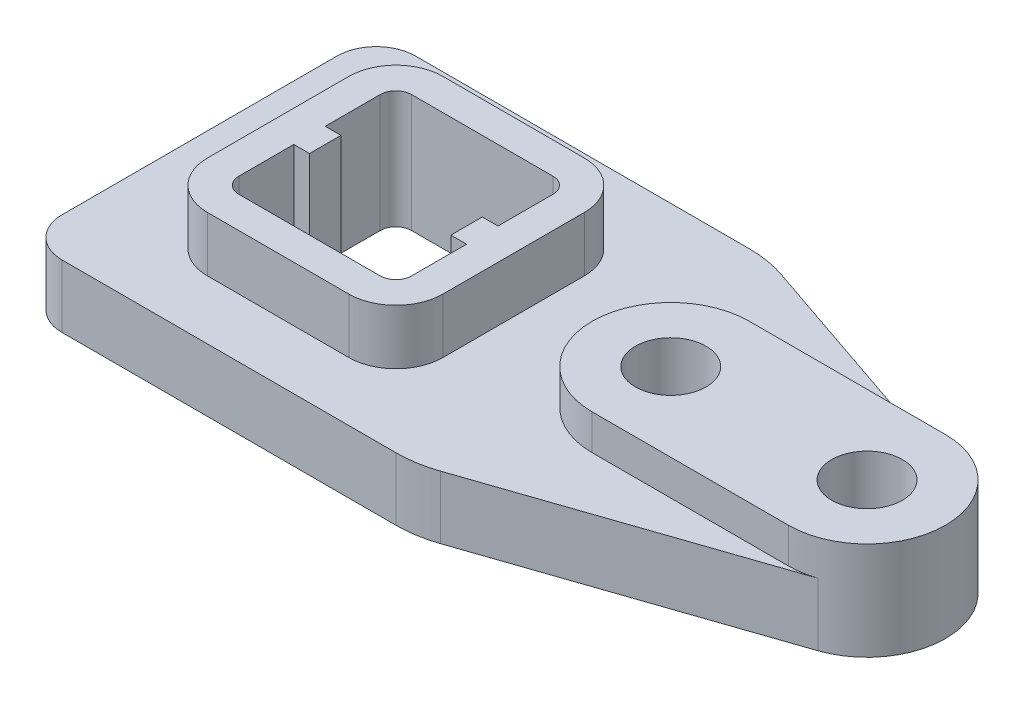
from build123d import *

# Parameters (mm, degrees)
SKETCH_1_W          = 100
SKETCH_1_H          = 90
EXTRUDE_1_DEPTH     = 16
FILLET_1_R          = 10
SKETCH_4_W          = 60
SKETCH_4_H          = 60
EXTRUDE_2_DEPTH     = 30
FILLET_3_R          = 12
CUT_EXTRUDE_1_DEPTH = 46
FILLET_4_R          = 4
EXTRUDE_4_DEPTH     = 16
SKETCH_10_R         = 9
EXTRUDE_5_DEPTH     = 25
FILLET_6_R          = 30


with BuildPart() as part:
    # 草图1 → 凸台-拉伸1 (new body)
    with BuildSketch(Plane(origin=(0, 0, 0), x_dir=(1, 0, 0), z_dir=(0, 1, 0))):
        with Locations((50, 0)):
            Rectangle(SKETCH_1_W, SKETCH_1_H)
    extrude(amount=EXTRUDE_1_DEPTH)

    # 圆角1
    fillet_1_edges = [part.edges().sort_by_distance(p)[0] for p in [
        (0, 8, -45),
        (0, 8, 45),
    ]]
    fillet(fillet_1_edges, radius=FILLET_1_R)

    # 草图4 → 凸台-拉伸2 (add)
    with BuildSketch(Plane(origin=(0, 0, 0), x_dir=(1, 0, 0), z_dir=(0, 1, 0))):
        with Locations((50, 0)):
            Rectangle(SKETCH_4_W, SKETCH_4_H)
    extrude(amount=EXTRUDE_2_DEPTH)

    # 圆角3
    fillet_3_edges = [part.edges().sort_by_distance(p)[0] for p in [
        (20, 23, -30),
        (20, 23, 30),
        (80, 23, 30),
        (80, 23, -30),
    ]]
    fillet(fillet_3_edges, radius=FILLET_3_R)

    # 草图5 → 切除-拉伸1 (cut)
    with BuildSketch(Plane(origin=(0, 0, 0), x_dir=(1, 0, 0), z_dir=(0, 1, 0))):
        Polygon((28, -4), (28, -22), (72, -22), (72, -4), (68, -4), (68, 4), (72, 4), (72, 22), (28, 22), (28, 4), (32, 4), (32, -4), align=None)
    extrude(amount=CUT_EXTRUDE_1_DEPTH, mode=Mode.SUBTRACT)

    # 圆角4
    fillet_4_edges = [part.edges().sort_by_distance(p)[0] for p in [
        (28, 15, -22),
        (28, 15, 22),
        (72, 15, 22),
        (72, 15, -22),
    ]]
    fillet(fillet_4_edges, radius=FILLET_4_R)

    # 草图9 → 凸台-拉伸4 (add)
    with BuildSketch(Plane(origin=(0, 0, 0), x_dir=(1, 0, 0), z_dir=(0, 1, 0))):
        with BuildLine():
            ThreePointArc((100, 1e-09), (105.857864376, 14.142135624), (120, 20))
            Line((120, 20), (168.98254652, 19.974102944))
            ThreePointArc((168.98254652, 19.974102944), (170.010573991, 19.999997205), (171.038573506, 19.973015923))
            ThreePointArc((171.038573506, 19.973015923), (173.782842055, 19.638994526), (176.45483392, 18.929741653))
            Line((176.45483392, 18.929741653), (100, 45))
            Line((100, 45), (100, 1e-09))
        make_face()
        with BuildLine():
            ThreePointArc((120, -20), (105.857864376, -14.142135623), (100, 1e-09))
            Line((100, 1e-09), (100, -45))
            Line((100, -45), (176.45483392, -18.929741653))
            ThreePointArc((176.45483392, -18.929741653), (173.271480317, -19.730621291), (170, -20))
            Line((170, -20), (120, -20))
        make_face()
    extrude(amount=EXTRUDE_4_DEPTH)

    # 草图10 → 凸台-拉伸5 (add)
    with BuildSketch(Plane(origin=(0, 0, 0), x_dir=(1, 0, 0), z_dir=(0, 1, 0))):
        with BuildLine():
            Line((120, 20), (170, 20))
            ThreePointArc((170, 20), (190, 0), (170, -20))
            Line((170, -20), (120, -20))
            ThreePointArc((120, -20), (100, 0), (120, 20))
        make_face()
        with Locations(Location((120, 0, 0), (0, 0, 270))):
            Circle(SKETCH_10_R, mode=Mode.SUBTRACT)
        with Locations(Location((170, 0, 0), (0, 0, 270))):
            Circle(SKETCH_10_R, mode=Mode.SUBTRACT)
    extrude(amount=EXTRUDE_5_DEPTH)

    # 圆角6
    fillet_6_edges = [part.edges().sort_by_distance(p)[0] for p in [
        (100, 8, -45),
        (100, 8, 45),
    ]]
    fillet(fillet_6_edges, radius=FILLET_6_R)


solid = part.part
